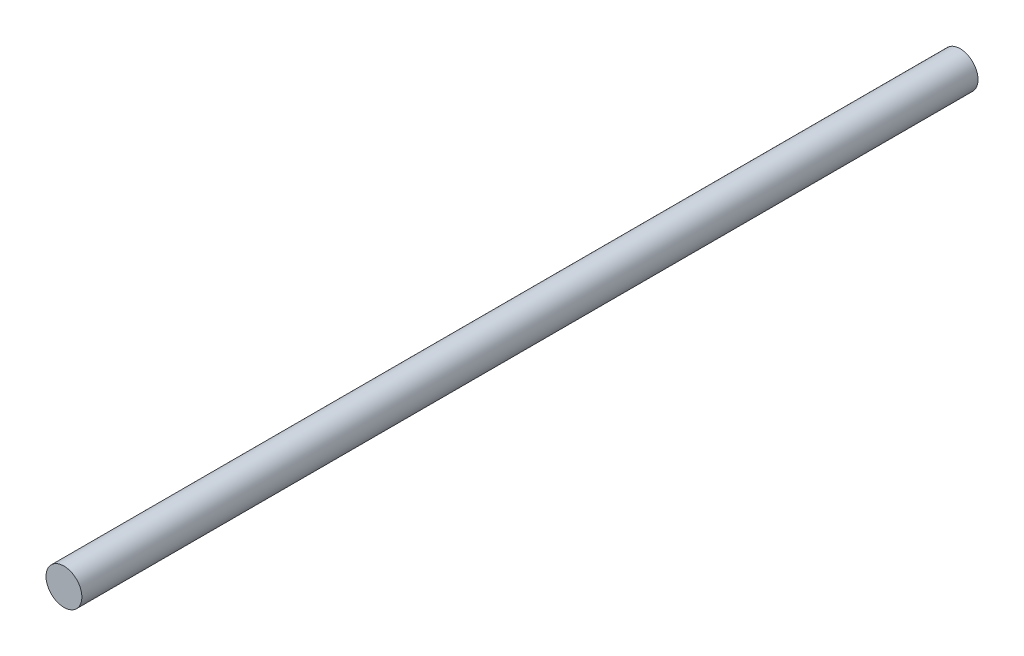
from build123d import *

# Parameters (mm, degrees)
SKETCH1_R           = 10
BOSS_EXTRUDE1_DEPTH = 500


with BuildPart() as part:
    # Sketch1 → Boss-Extrude1 (new body)
    with BuildSketch(Plane.XY):
        with Locations(Location((0, 0, 0), (0, 0, 180))):
            Circle(SKETCH1_R)
    extrude(amount=BOSS_EXTRUDE1_DEPTH)


solid = part.part
